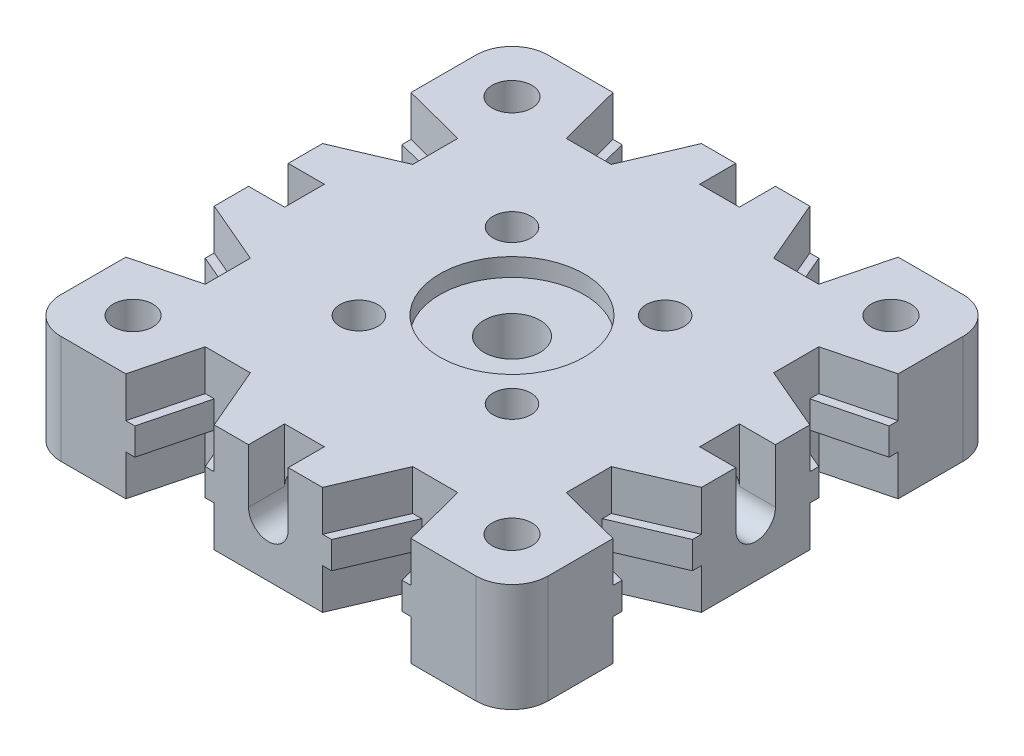
from build123d import *

# Parameters (mm, degrees)
SKETCH_3_W                      = 27
SKETCH_3_H                      = 27
EXTRUDE_1_DEPTH                 = 3
FILLET_1_R                      = 2
SKETCH_4_R                      = 1.1
CUT_EXTRUDE_1_DEPTH             = 6
SKETCH_5_R                      = 1.55
CUT_EXTRUDE_2_DEPTH             = 6
SKETCH_6_R                      = 1.05
CUT_EXTRUDE_3_DEPTH             = 6
PATTERN_CIRCULAR_1_COUNT        = 4
SKETCH_7_R                      = 4
CUT_EXTRUDE_4_DEPTH             = 1
CUT_EXTRUDE_8_DEPTH             = 21.012496096
PATTERN_CIRCULAR_2_COUNT        = 4
PATTERN_CIRCULAR_2_COPY_1_DEPTH = 21.012496096
PATTERN_CIRCULAR_2_COPY_2_DEPTH = 21.012496096
PATTERN_CIRCULAR_2_COPY_3_DEPTH = 21.012496096
SKETCH_12_R                     = 1.1
CUT_EXTRUDE_9_DEPTH             = 8
PATTERN_CIRCULAR_3_COUNT        = 4
EXTRUDE_2_DEPTH                 = 0.75
PATTERN_CIRCULAR_4_COUNT        = 4
PATTERN_CIRCULAR_4_COPY_1_DEPTH = 0.75
PATTERN_CIRCULAR_4_COPY_2_DEPTH = 0.75
PATTERN_CIRCULAR_4_COPY_3_DEPTH = 0.75
SKETCH_22_W                     = 2.2
SKETCH_22_H                     = 3
CUT_EXTRUDE_15_DEPTH            = 2
PATTERN_CIRCULAR_11_COUNT       = 4


with BuildPart() as part:
    # ｽｹｯﾁ3 → ﾎﾞｽ - 押し出し1 (new, symmetric)
    with BuildSketch(Plane(origin=(0, 0, 0), x_dir=(1, 0, 0), z_dir=(0, 1, 0))):
        Rectangle(SKETCH_3_W, SKETCH_3_H)
    extrude(amount=EXTRUDE_1_DEPTH, both=True)

    # ﾌｨﾚｯﾄ1
    fillet_1_edges = [part.edges().sort_by_distance(p)[0] for p in [
        (13.5, 0, 13.5),
        (-13.5, 0, 13.5),
        (-13.5, 0, -13.5),
        (13.5, 0, -13.5),
    ]]
    fillet(fillet_1_edges, radius=FILLET_1_R)

    # ｽｹｯﾁ4 → ｶｯﾄ - 押し出し1 (cut)
    with BuildSketch(Plane(origin=(0, 3, 0), x_dir=(1, 0, 0), z_dir=(0, 1, 0))):
        with Locations(Location((-10.5, 10.5, 0), (0, 0, 270))):
            Circle(SKETCH_4_R)
        with Locations(Location((10.5, 10.5, 0), (0, 0, 270))):
            Circle(SKETCH_4_R)
        with Locations(Location((-10.5, -10.5, 0), (0, 0, 270))):
            Circle(SKETCH_4_R)
        with Locations(Location((10.5, -10.5, 0), (0, 0, 270))):
            Circle(SKETCH_4_R)
    extrude(amount=-CUT_EXTRUDE_1_DEPTH, mode=Mode.SUBTRACT)

    # ｽｹｯﾁ5 → ｶｯﾄ - 押し出し2 (cut)
    with BuildSketch(Plane(origin=(0, 3, 0), x_dir=(1, 0, 0), z_dir=(0, 1, 0))):
        with Locations(Location((0, 0, 0), (0, 0, 270))):
            Circle(SKETCH_5_R)
    extrude(amount=-CUT_EXTRUDE_2_DEPTH, mode=Mode.SUBTRACT)

    # ｽｹｯﾁ6 → ｶｯﾄ - 押し出し3 (cut)
    with BuildSketch(Plane(origin=(0, 3, 0), x_dir=(1, 0, 0), z_dir=(0, 1, 0))):
        with Locations(Location((4.242640687, 4.242640687, 0), (0, 0, 270))):
            Circle(SKETCH_6_R)
    cut_extrude_3 = extrude(amount=-CUT_EXTRUDE_3_DEPTH, mode=Mode.SUBTRACT)

    # 円形ﾊﾟﾀｰﾝ1: ｶｯﾄ - 押し出し3 ×4 about axis
    pattern_circular_1_axis = Axis((0, 0, 0), (0, 1, 0))
    for i in range(1, PATTERN_CIRCULAR_1_COUNT):
        add(cut_extrude_3.rotate(pattern_circular_1_axis, i * 360 / PATTERN_CIRCULAR_1_COUNT), mode=Mode.SUBTRACT)

    # ｽｹｯﾁ7 → ｶｯﾄ - 押し出し4 (cut)
    with BuildSketch(Plane(origin=(0, 3, 0), x_dir=(1, 0, 0), z_dir=(0, 1, 0))):
        with Locations(Location((0, 0, 0), (0, 0, 270))):
            Circle(SKETCH_7_R)
    extrude(amount=-CUT_EXTRUDE_4_DEPTH, mode=Mode.SUBTRACT)

    # ｽｹｯﾁ11 → ｶｯﾄ - 押し出し8 (cut, symmetric)
    with BuildSketch(Plane(origin=(0, 3, 0), x_dir=(1, 0, 0), z_dir=(0, 1, 0))):
        Polygon((-28.082033535, 86.024744916), (3, 13.5), (4.5, 10), (7, 10), (7.9, 13.5), (27.55047658, 89.918520033), (16.532211377, 247.342544779), (-39.100298738, 243.448769662), align=None)
    cut_extrude_8 = extrude(amount=CUT_EXTRUDE_8_DEPTH, both=True, mode=Mode.SUBTRACT)

    # ﾐﾗｰ1: ｶｯﾄ - 押し出し8 across plane
    add(cut_extrude_8.mirror(Plane(origin=(0, 0, 0), x_dir=(0, 0, 1), z_dir=(1, 0, 0))), mode=Mode.SUBTRACT)

    # 円形ﾊﾟﾀｰﾝ2: ｶｯﾄ - 押し出し8 ×4 about axis
    pattern_circular_2_axis = Axis((0, 0, 0), (0, 1, 0))
    for i in range(1, PATTERN_CIRCULAR_2_COUNT):
        add(cut_extrude_8.rotate(pattern_circular_2_axis, i * 360 / PATTERN_CIRCULAR_2_COUNT), mode=Mode.SUBTRACT)

    # 円形ﾊﾟﾀｰﾝ2 copy 1 sketch → 円形ﾊﾟﾀｰﾝ2 copy 1 (cut, symmetric)
    with BuildSketch(Plane.ZX.offset(3)):
        Polygon((-28.082033535, -86.024744916), (3, -13.5), (4.5, -10), (7, -10), (7.9, -13.5), (27.55047658, -89.918520033), (16.532211377, -247.342544779), (-39.100298738, -243.448769662), align=None)
    extrude(amount=PATTERN_CIRCULAR_2_COPY_1_DEPTH, both=True, mode=Mode.SUBTRACT)

    # 円形ﾊﾟﾀｰﾝ2 copy 2 sketch → 円形ﾊﾟﾀｰﾝ2 copy 2 (cut, symmetric)
    with BuildSketch(Plane(origin=(0, 3, 0), x_dir=(1, 0, 0), z_dir=(0, 1, 0))):
        Polygon((-28.082033535, -86.024744916), (3, -13.5), (4.5, -10), (7, -10), (7.9, -13.5), (27.55047658, -89.918520033), (16.532211377, -247.342544779), (-39.100298738, -243.448769662), align=None)
    extrude(amount=PATTERN_CIRCULAR_2_COPY_2_DEPTH, both=True, mode=Mode.SUBTRACT)

    # 円形ﾊﾟﾀｰﾝ2 copy 3 sketch → 円形ﾊﾟﾀｰﾝ2 copy 3 (cut, symmetric)
    with BuildSketch(Plane(origin=(0, 3, 0), x_dir=(0, 0, -1), z_dir=(0, 1, 0))):
        Polygon((-28.082033535, -86.024744916), (3, -13.5), (4.5, -10), (7, -10), (7.9, -13.5), (27.55047658, -89.918520033), (16.532211377, -247.342544779), (-39.100298738, -243.448769662), align=None)
    extrude(amount=PATTERN_CIRCULAR_2_COPY_3_DEPTH, both=True, mode=Mode.SUBTRACT)

    # ｽｹｯﾁ12 → ｶｯﾄ - 押し出し9 (cut)
    with BuildSketch(Plane.XY.offset(13.5)):
        Circle(SKETCH_12_R)
    cut_extrude_9 = extrude(amount=-CUT_EXTRUDE_9_DEPTH, mode=Mode.SUBTRACT)

    # 円形ﾊﾟﾀｰﾝ3: ｶｯﾄ - 押し出し9 ×4 about axis
    pattern_circular_3_axis = Axis((0, 0, 0), (0, 1, 0))
    for i in range(1, PATTERN_CIRCULAR_3_COUNT):
        add(cut_extrude_9.rotate(pattern_circular_3_axis, i * 360 / PATTERN_CIRCULAR_3_COUNT), mode=Mode.SUBTRACT)

    # ｽｹｯﾁ13 → ﾎﾞｽ - 押し出し2 (add, symmetric)
    with BuildSketch(Plane(origin=(0, 0, 0), x_dir=(1, 0, 0), z_dir=(0, 1, 0))):
        Polygon((7.9, 13.5), (7, 10), (6.5, 10), (7.4, 13.5), align=None)
        Polygon((3, 13.5), (3.5, 13.5), (5, 10), (4.5, 10), align=None)
    extrude_2 = extrude(amount=EXTRUDE_2_DEPTH, both=True)

    # ﾐﾗｰ2: ﾎﾞｽ - 押し出し2 across plane
    add(extrude_2.mirror(Plane(origin=(0, 0, 0), x_dir=(0, 0, 1), z_dir=(1, 0, 0))))

    # 円形ﾊﾟﾀｰﾝ4: ﾎﾞｽ - 押し出し2 ×4 about axis
    pattern_circular_4_axis = Axis((0, 0, 0), (0, 1, 0))
    for i in range(1, PATTERN_CIRCULAR_4_COUNT):
        add(extrude_2.rotate(pattern_circular_4_axis, i * 360 / PATTERN_CIRCULAR_4_COUNT))

    # 円形ﾊﾟﾀｰﾝ4 copy 1 sketch → 円形ﾊﾟﾀｰﾝ4 copy 1 (add, symmetric)
    with BuildSketch(Plane.ZX):
        Polygon((7.9, -13.5), (7, -10), (6.5, -10), (7.4, -13.5), align=None)
        Polygon((3, -13.5), (3.5, -13.5), (5, -10), (4.5, -10), align=None)
    extrude(amount=PATTERN_CIRCULAR_4_COPY_1_DEPTH, both=True)

    # 円形ﾊﾟﾀｰﾝ4 copy 2 sketch → 円形ﾊﾟﾀｰﾝ4 copy 2 (add, symmetric)
    with BuildSketch(Plane(origin=(0, 0, 0), x_dir=(1, 0, 0), z_dir=(0, 1, 0))):
        Polygon((7.9, -13.5), (7, -10), (6.5, -10), (7.4, -13.5), align=None)
        Polygon((3, -13.5), (3.5, -13.5), (5, -10), (4.5, -10), align=None)
    extrude(amount=PATTERN_CIRCULAR_4_COPY_2_DEPTH, both=True)

    # 円形ﾊﾟﾀｰﾝ4 copy 3 sketch → 円形ﾊﾟﾀｰﾝ4 copy 3 (add, symmetric)
    with BuildSketch(Plane(origin=(0, 0, 0), x_dir=(0, 0, -1), z_dir=(0, 1, 0))):
        Polygon((7.9, -13.5), (7, -10), (6.5, -10), (7.4, -13.5), align=None)
        Polygon((3, -13.5), (3.5, -13.5), (5, -10), (4.5, -10), align=None)
    extrude(amount=PATTERN_CIRCULAR_4_COPY_3_DEPTH, both=True)

    # ｽｹｯﾁ22 → ｶｯﾄ - 押し出し15 (cut)
    with BuildSketch(Plane.XY.offset(13.5)):
        with Locations((0, 1.5)):
            Rectangle(SKETCH_22_W, SKETCH_22_H)
    cut_extrude_15 = extrude(amount=-CUT_EXTRUDE_15_DEPTH, mode=Mode.SUBTRACT)

    # 円形ﾊﾟﾀｰﾝ11: ｶｯﾄ - 押し出し15 ×4 about axis
    pattern_circular_11_axis = Axis((0, 0, 0), (0, 1, 0))
    for i in range(1, PATTERN_CIRCULAR_11_COUNT):
        add(cut_extrude_15.rotate(pattern_circular_11_axis, i * 360 / PATTERN_CIRCULAR_11_COUNT), mode=Mode.SUBTRACT)


solid = part.part
